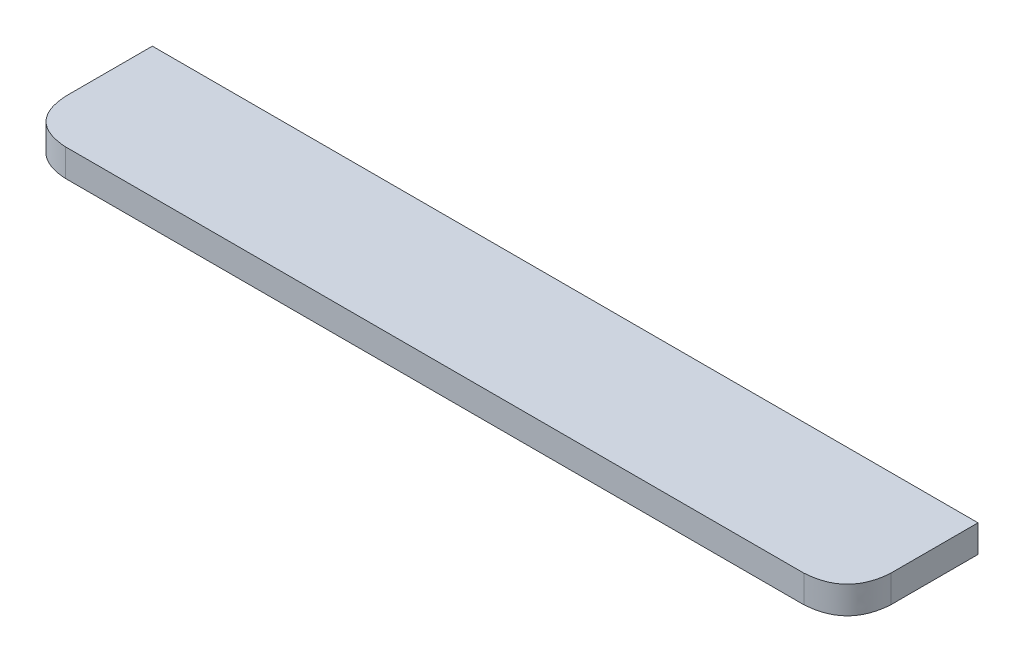
from build123d import *

# Parameters (mm, degrees)
BOSS_EXTRUDE1_DEPTH = 8


with BuildPart() as part:
    # Sketch2 → Boss-Extrude1 (new body)
    with BuildSketch(Plane(origin=(0, 0, 0), x_dir=(1, 0, 0), z_dir=(0, 1, 0))):
        with BuildLine():
            Line((-107.696, -25.4), (107.696, -25.4))
            add(Edge.make_bspline(
                [(107.696, -25.4), (119.665722487, -24.669722487), (120.396, -12.7)],
                knots=[0, 0, 0, 1, 1, 1], degree=2))
            Line((120.396, -12.7), (120.396, 12.7))
            Line((120.396, 12.7), (-120.396, 12.7))
            Line((-120.396, 12.7), (-120.396, -12.7))
            add(Edge.make_bspline(
                [(-107.696, -25.4), (-119.665722487, -24.669722487), (-120.396, -12.7)],
                knots=[0, 0, 0, 1, 1, 1], degree=2))
        make_face()
    extrude(amount=BOSS_EXTRUDE1_DEPTH)


solid = part.part
